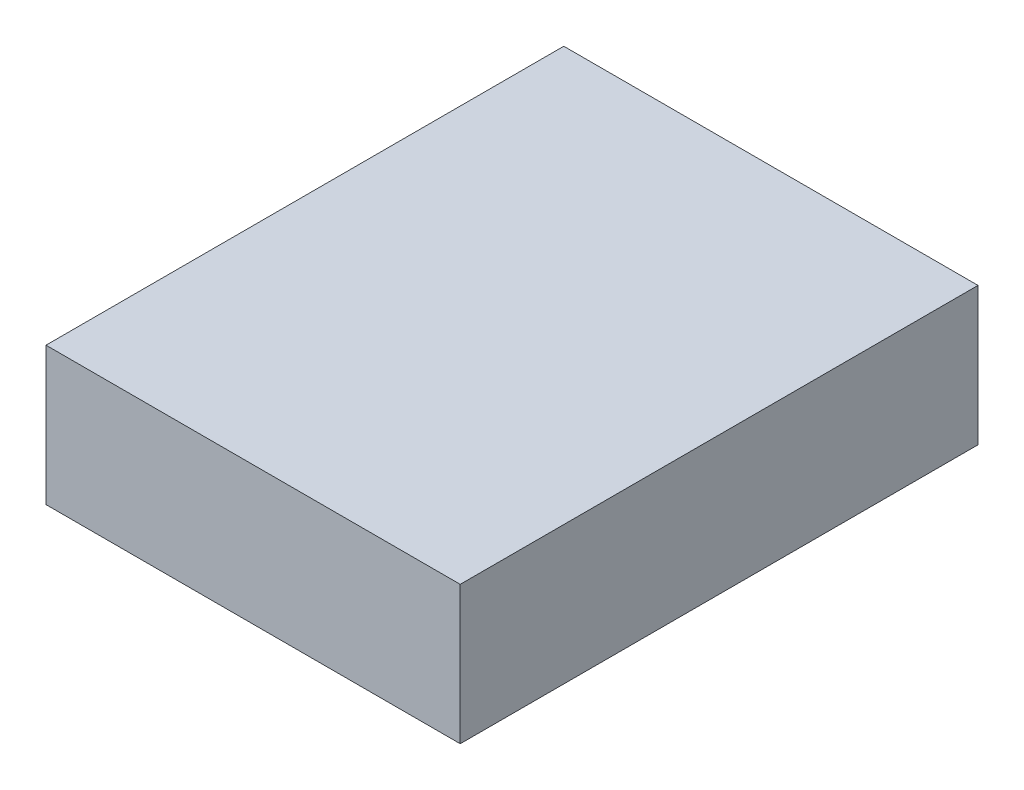
from build123d import *

# Parameters (mm, degrees)
SKETCH1_W           = 60
SKETCH1_H           = 75
BOSS_EXTRUDE1_DEPTH = 20


with BuildPart() as part:
    # Sketch1 → Boss-Extrude1 (new body)
    with BuildSketch(Plane(origin=(0, 0, 0), x_dir=(1, 0, 0), z_dir=(0, 1, 0))):
        Rectangle(SKETCH1_W, SKETCH1_H)
    extrude(amount=BOSS_EXTRUDE1_DEPTH)


solid = part.part
